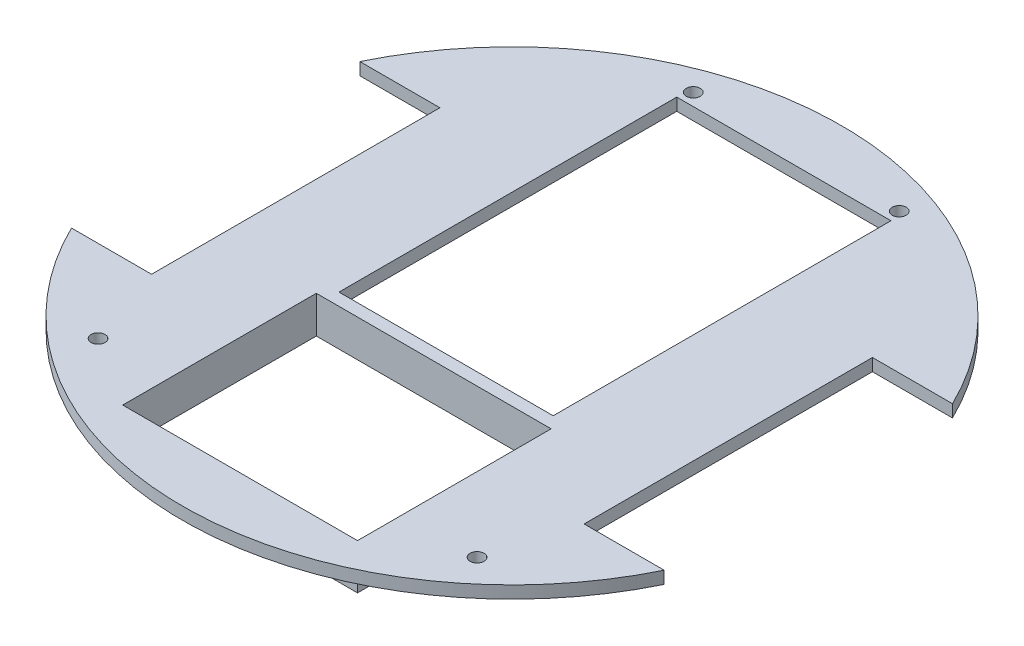
from build123d import *

# Parameters (mm, degrees)
ESQUISSE1_R             = 80
BOSS_EXTRU_1_DEPTH      = 3
ESQUISSE2_W             = 55
ESQUISSE2_H             = 70
ENL_V_MAT_EXTRU_1_DEPTH = 114.176852757
D_GAGEMENT_M31_D        = 3.4
D_GAGEMENT_M31_DEPTH    = 24
D_GAGEMENT_M31_TIP      = 1.021463052
ESQUISSE11_W            = 52
ESQUISSE11_H            = 82
ESQUISSE11_W_2          = 57
ESQUISSE11_H_2          = 47
ENL_V_MAT_EXTRU_2_DEPTH = 108.628992377
ESQUISSE12_W            = 61
ESQUISSE12_H            = 51
ESQUISSE12_W_2          = 57
ESQUISSE12_H_2          = 47
BOSS_EXTRU_2_DEPTH      = 6


with BuildPart() as part:
    # Esquisse1 → Boss.-Extru.1 (new body)
    with BuildSketch(Plane(origin=(0, 0, 0), x_dir=(1, 0, 0), z_dir=(0, 1, 0))):
        with Locations(Location((0, 0, 0), (0, 0, 270))):
            Circle(ESQUISSE1_R)
    extrude(amount=BOSS_EXTRU_1_DEPTH)

    # Esquisse2 → Enlèv. mat.-Extru.1 (cut, through all)
    with BuildSketch(Plane(origin=(0, 3, 0), x_dir=(1, 0, 0), z_dir=(0, 1, 0))):
        with Locations((-80, 0)):
            Rectangle(ESQUISSE2_W, ESQUISSE2_H)
        with Locations((80, 0)):
            Rectangle(ESQUISSE2_W, ESQUISSE2_H)
    extrude(amount=-ENL_V_MAT_EXTRU_1_DEPTH, mode=Mode.SUBTRACT)

    # Dégagement M31
    with Locations(Plane(origin=(0, 3, 0), x_dir=(1, 0, 0), z_dir=(0, 1, 0))):
        with Locations((-45.483572208, -55), (46.516427792, -55), (-25, 69), (25, 69)):
            Hole(D_GAGEMENT_M31_D / 2, depth=D_GAGEMENT_M31_DEPTH)
            with Locations((0, 0, -(D_GAGEMENT_M31_DEPTH + D_GAGEMENT_M31_TIP / 2))):  # 118° drill point
                Cone(0, D_GAGEMENT_M31_D / 2, D_GAGEMENT_M31_TIP, mode=Mode.SUBTRACT)

    # Esquisse11 → Enlèv. mat.-Extru.2 (cut, through all)
    with BuildSketch(Plane(origin=(0, 3, 0), x_dir=(1, 0, 0), z_dir=(0, 1, 0))):
        with Locations((0, 25)):
            Rectangle(ESQUISSE11_W, ESQUISSE11_H)
        with Locations((0, -42.5)):
            Rectangle(ESQUISSE11_W_2, ESQUISSE11_H_2)
    extrude(amount=-ENL_V_MAT_EXTRU_2_DEPTH, mode=Mode.SUBTRACT)

    # Esquisse12 → Boss.-Extru.2 (add)
    with BuildSketch(Plane.XZ):
        with Locations((0, 42.5)):
            Rectangle(ESQUISSE12_W, ESQUISSE12_H)
        with Locations((0, 42.5)):
            Rectangle(ESQUISSE12_W_2, ESQUISSE12_H_2, mode=Mode.SUBTRACT)
    extrude(amount=BOSS_EXTRU_2_DEPTH)


solid = part.part
